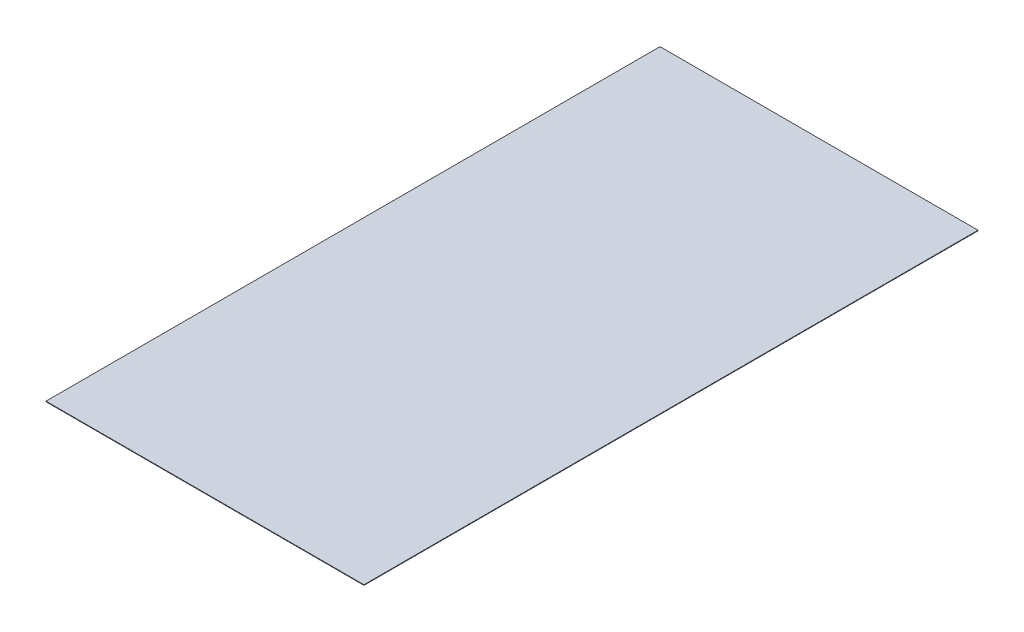
from build123d import *

# Parameters (mm, degrees)
ESQUISSE1_W        = 5800
ESQUISSE1_H        = 11200
BOSS_EXTRU_1_DEPTH = 10


with BuildPart() as part:
    # Esquisse1 → Boss.-Extru.1 (new body)
    with BuildSketch(Plane(origin=(0, 0, 0), x_dir=(1, 0, 0), z_dir=(0, 1, 0))):
        Rectangle(ESQUISSE1_W, ESQUISSE1_H)
    extrude(amount=BOSS_EXTRU_1_DEPTH)


solid = part.part
